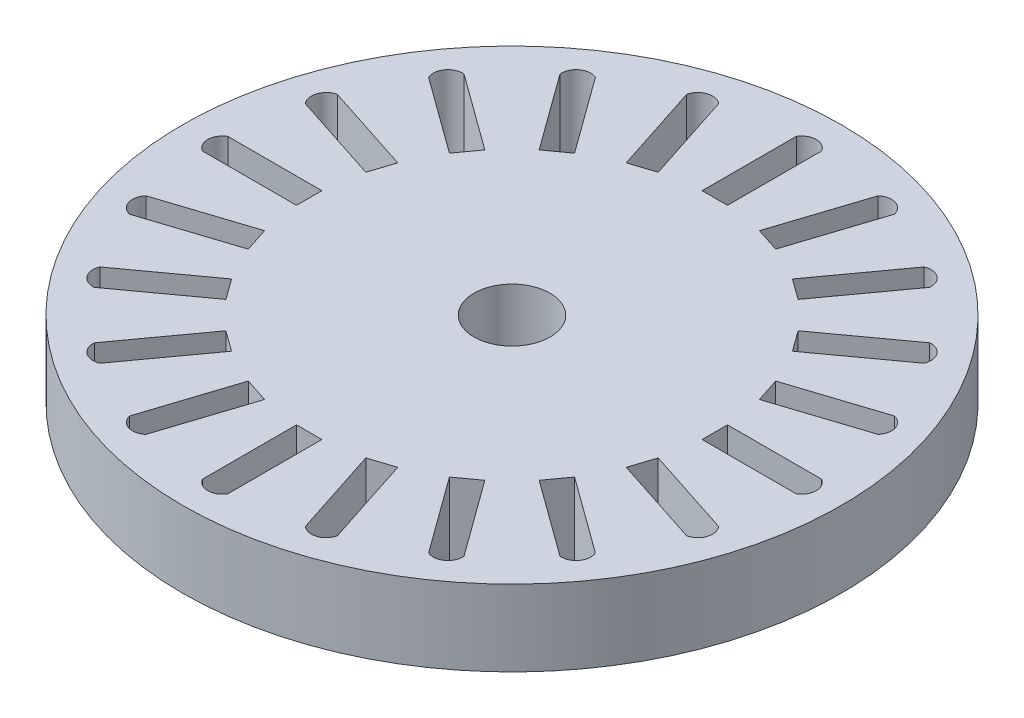
from build123d import *

# Parameters (mm, degrees)
CROQUIS1_R              = 13
CROQUIS1_R_2            = 1.5
SALIENTE_EXTRUIR1_DEPTH = 3
CORTAR_EXTRUIR1_DEPTH   = 3
MATRIZC1_COUNT          = 20


with BuildPart() as part:
    # Croquis1 → Saliente-Extruir1 (new body)
    with BuildSketch(Plane(origin=(0, 0, 0), x_dir=(1, 0, 0), z_dir=(0, 1, 0))):
        with Locations(Location((0, 0, 0), (0, 0, 270))):
            Circle(CROQUIS1_R)
        with Locations(Location((0, 0, 0), (0, 0, 270))):
            Circle(CROQUIS1_R_2, mode=Mode.SUBTRACT)
    extrude(amount=SALIENTE_EXTRUIR1_DEPTH)

    # Croquis2 → Cortar-Extruir1 (cut)
    with BuildSketch(Plane(origin=(0, 3, 0), x_dir=(1, 0, 0), z_dir=(0, 1, 0))):
        with BuildLine():
            Line((-0.5, 8), (0.5, 8))
            Line((0.5, 8), (0.5, 11.712659584))
            ThreePointArc((0.5, 11.712659584), (0.000139252, 12), (-0.5, 11.713144616))
            Line((-0.5, 11.713144616), (-0.5, 8))
        make_face()
    cortar_extruir1 = extrude(amount=-CORTAR_EXTRUIR1_DEPTH, mode=Mode.SUBTRACT)

    # MatrizC1: Cortar-Extruir1 ×20 about axis
    matrizc1_axis = Axis((0, 0, 0), (0, 1, 0))
    for i in range(1, MATRIZC1_COUNT):
        add(cortar_extruir1.rotate(matrizc1_axis, i * 360 / MATRIZC1_COUNT), mode=Mode.SUBTRACT)


solid = part.part
